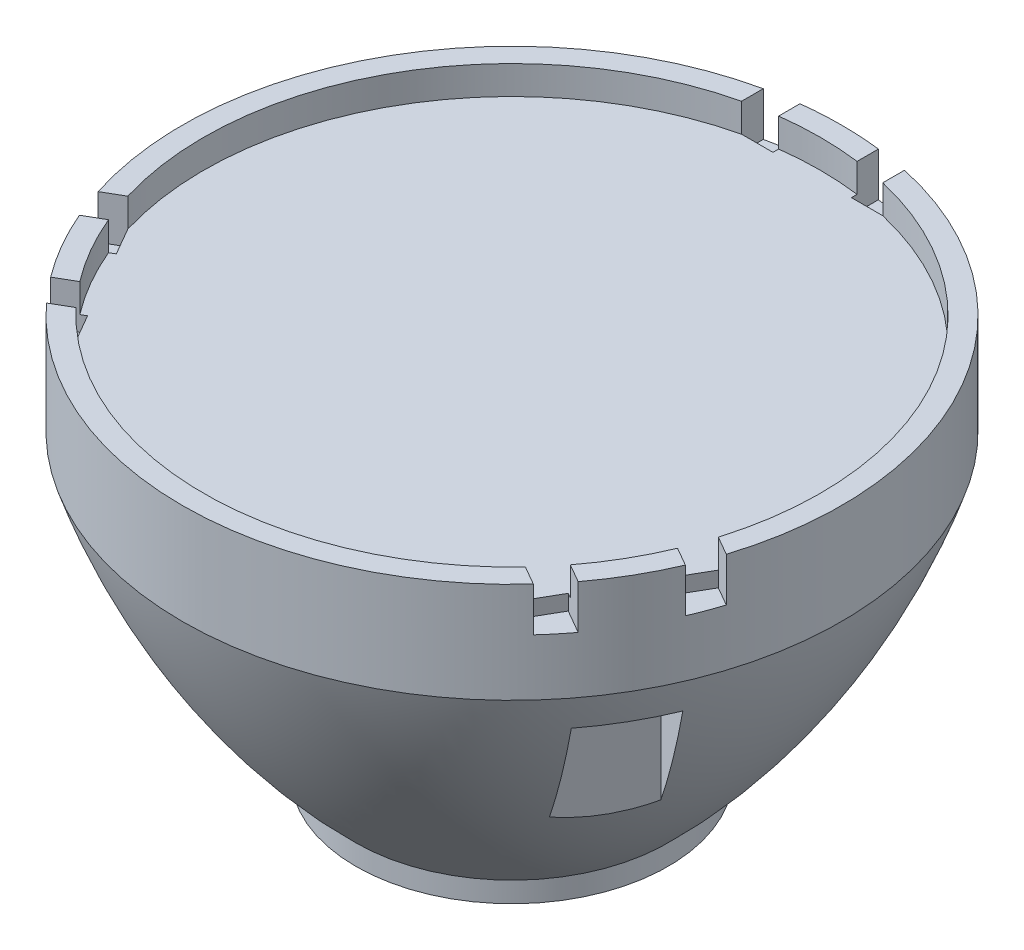
from build123d import *

# Parameters (mm, degrees)
SKETCH3_R                    = 9.825
LENS_TOP_CUT_EXTRUDE2_DEPTH  = 0.91
SKETCH2_W                    = 1
SKETCH2_H                    = 0.861432774
TOP_CUT_EXTRUDE3_DEPTH       = 1.4
BOTTOM_CUT_EXTRUDE4_DEPTH    = 0.8
SIDE_CUT_EXTRUDE5_DEPTH      = 8
SKETCH6_R                    = 2.6
LENS_HOLE_CUT_EXTRUDE7_DEPTH = 5


with BuildPart() as part:
    # Sketch1 → Lens Holder (revolve)
    with BuildSketch(Plane.XY, mode=Mode.PRIVATE) as lens_holder_sk:
        with BuildLine():
            Line((0, 0), (4.975, 0))
            Line((4.975, 0), (4.975, 0.65))
            ThreePointArc((4.975, 0.65), (8.271800133, 4.752191856), (10.5, 9.52))
            Line((10.5, 9.52), (10.5, 12.72))
            Line((10.5, 12.72), (0, 12.72))
            Line((0, 12.72), (0, 0))
        make_face()
    revolve(lens_holder_sk.sketch.rotate(Axis((0, 0, 0), (0, 1, 0)), 90), axis=Axis((0, 0, 0), (0, 1, 0)))

    # Sketch3 → Lens Top Cut-Extrude2 (cut)
    with BuildSketch(Plane(origin=(0, 12.72, 0), x_dir=(1, 0, 0), z_dir=(0, 1, 0))):
        with Locations(Location((0, 0, 0), (0, 0, 270))):
            Circle(SKETCH3_R)
    extrude(amount=-LENS_TOP_CUT_EXTRUDE2_DEPTH, mode=Mode.SUBTRACT)

    # Sketch2 → Top Cut-Extrude3 (cut)
    with BuildSketch(Plane(origin=(0, 12.72, 0), x_dir=(1, 0, 0), z_dir=(0, 1, 0))):
        Polygon((8.40360039, -6.29519662), (7.90360039, -7.161222024), (7.157577724, -6.730505637), (7.657577724, -5.864480233), align=None)
        with Locations((1.75, 9.994613344)):
            Rectangle(SKETCH2_W, SKETCH2_H)
        with Locations((-1.75, 9.994613344)):
            Rectangle(SKETCH2_W, SKETCH2_H)
        Polygon((10.15360039, -3.264107707), (9.65360039, -4.130133111), (8.907577724, -3.699416724), (9.407577724, -2.83339132), align=None)
        Polygon((-9.65360039, -4.130133111), (-10.15360039, -3.264107707), (-9.407577724, -2.83339132), (-8.907577724, -3.699416724), align=None)
        Polygon((-7.90360039, -7.161222024), (-8.40360039, -6.29519662), (-7.657577724, -5.864480233), (-7.157577724, -6.730505637), align=None)
    extrude(amount=-TOP_CUT_EXTRUDE3_DEPTH, mode=Mode.SUBTRACT)

    # Sketch4 → Bottom Cut-Extrude4 (cut)
    with BuildSketch(Plane.XZ):
        Polygon((2.49, 1.8), (1.99, 1.3), (2.49, 0.8), (2.49, -0.8), (1.99, -1.3), (2.49, -1.8), (2.49, -2.49), (1.8, -2.49), (1.3, -1.99), (0.8, -2.49), (-0.8, -2.49), (-1.3, -1.99), (-1.8, -2.49), (-2.49, -2.49), (-2.49, -1.8), (-1.99, -1.3), (-2.49, -0.8), (-2.49, 0.8), (-1.99, 1.3), (-2.49, 1.8), (-2.49, 2.49), (-1.8, 2.49), (-1.3, 1.99), (-0.8, 2.49), (0.8, 2.49), (1.3, 1.99), (1.8, 2.49), (2.49, 2.49), align=None)
    extrude(amount=-BOTTOM_CUT_EXTRUDE4_DEPTH, mode=Mode.SUBTRACT)

    # Sketch5 → Side Cut-Extrude5 (cut)
    with BuildSketch(Plane(origin=(0, 9.52, 0), x_dir=(1, 0, 0), z_dir=(0, 1, 0))):
        with BuildLine():
            Line((-1.3, 10.01598722), (-1.3, 8.1))
            Line((-1.3, 8.1), (1.3, 8.1))
            Line((1.3, 8.1), (1.3, 10.01598722))
            ThreePointArc((1.3, 10.01598722), (0, 10.1), (-1.3, 10.01598722))
        make_face()
        with BuildLine():
            Line((8.024099377, -6.133826635), (6.364805771, -5.175833025))
            Line((6.364805771, -5.175833025), (7.664805771, -2.924166975))
            Line((7.664805771, -2.924166975), (9.324099377, -3.882160585))
            ThreePointArc((9.324099377, -3.882160585), (8.746856578, -5.05), (8.024099377, -6.133826635))
        make_face()
        with BuildLine():
            Line((-9.324099377, -3.882160585), (-7.664805771, -2.924166975))
            Line((-7.664805771, -2.924166975), (-6.364805771, -5.175833025))
            Line((-6.364805771, -5.175833025), (-8.024099377, -6.133826635))
            ThreePointArc((-8.024099377, -6.133826635), (-8.746856578, -5.05), (-9.324099377, -3.882160585))
        make_face()
    extrude(amount=-SIDE_CUT_EXTRUDE5_DEPTH, mode=Mode.SUBTRACT)

    # Sketch6 → Lens Hole Cut-Extrude7 (cut)
    with BuildSketch(Plane.XZ.offset(-0.8)):
        with Locations(Location((0, 0, 0), (0, 0, 270))):
            Circle(SKETCH6_R)
    extrude(amount=-LENS_HOLE_CUT_EXTRUDE7_DEPTH, mode=Mode.SUBTRACT)


solid = part.part
